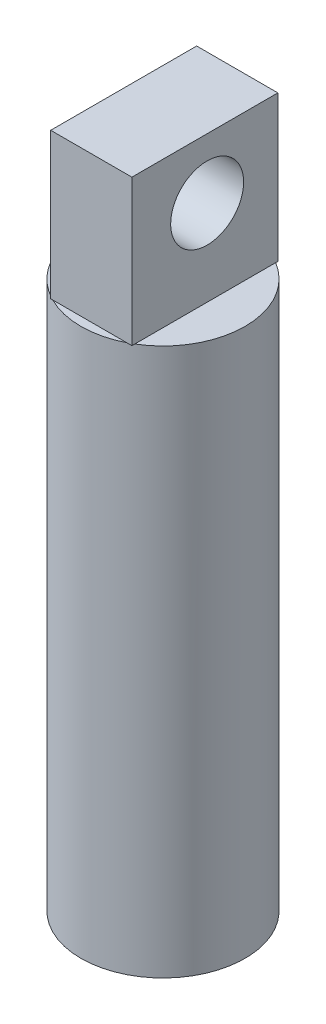
from build123d import *

# Parameters (mm, degrees)
ESQUISSE1_W             = 4.45
ESQUISSE1_H             = 8
BOSS_EXTRU_1_DEPTH      = 8
ESQUISSE2_R             = 4.5
BOSS_EXTRU_2_DEPTH      = 30
ESQUISSE4_R             = 2
ENL_V_MAT_EXTRU_1_DEPTH = 18


with BuildPart() as part:
    # Esquisse1 → Boss.-Extru.1 (new body)
    with BuildSketch(Plane.XY):
        with Locations((0.087605016, -1.300333333)):
            Rectangle(ESQUISSE1_W, ESQUISSE1_H)
    extrude(amount=BOSS_EXTRU_1_DEPTH)

    # Esquisse2 → Boss.-Extru.2 (add)
    with BuildSketch(Plane.XZ.offset(5.300333333)):
        with Locations(Location((0, 3.983435039, 0), (0, 0, 63.197988835))):
            Circle(ESQUISSE2_R)
    extrude(amount=BOSS_EXTRU_2_DEPTH)

    # Esquisse4 → Enlèv. mat.-Extru.1 (cut)
    with BuildSketch(Plane(origin=(2.312605016, 0, 0), x_dir=(0, 0, -1), z_dir=(1, 0, 0))):
        with Locations(Location((-3.87570667, -0.589342017, 0), (0, 0, 90))):
            Circle(ESQUISSE4_R)
    extrude(amount=-ENL_V_MAT_EXTRU_1_DEPTH, mode=Mode.SUBTRACT)


solid = part.part
